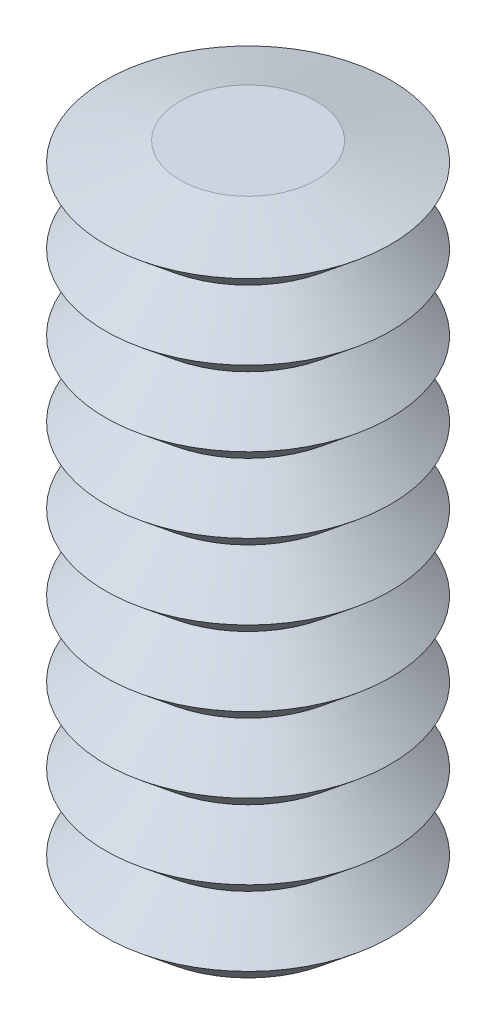
from build123d import *


with BuildPart() as part:
    # Sketch1 → Elemento_elastico_en_serie (revolve)
    with BuildSketch(Plane.XY, mode=Mode.PRIVATE) as elemento_elastico_en_serie_sk:
        Polygon((0, 0), (1.82, 0), (3.8, -0.5), (2.6, -1.5), (3.8, -2.5), (2.6, -3.5), (3.8, -4.5), (2.6, -5.5), (3.8, -6.5), (2.6, -7.5), (3.8, -8.5), (2.6, -9.5), (3.8, -10.5), (2.6, -11.5), (3.8, -12.5), (2.6, -13.5), (3.8, -14.5), (2.6, -15.5), (3.8, -16.5), (2.6, -17.5), (1.82, -18), (0, -18), align=None)
    revolve(elemento_elastico_en_serie_sk.sketch.rotate(Axis((0, -22, 0), (0, 1, 0)), 90), axis=Axis((0, -22, 0), (0, 1, 0)))


solid = part.part
